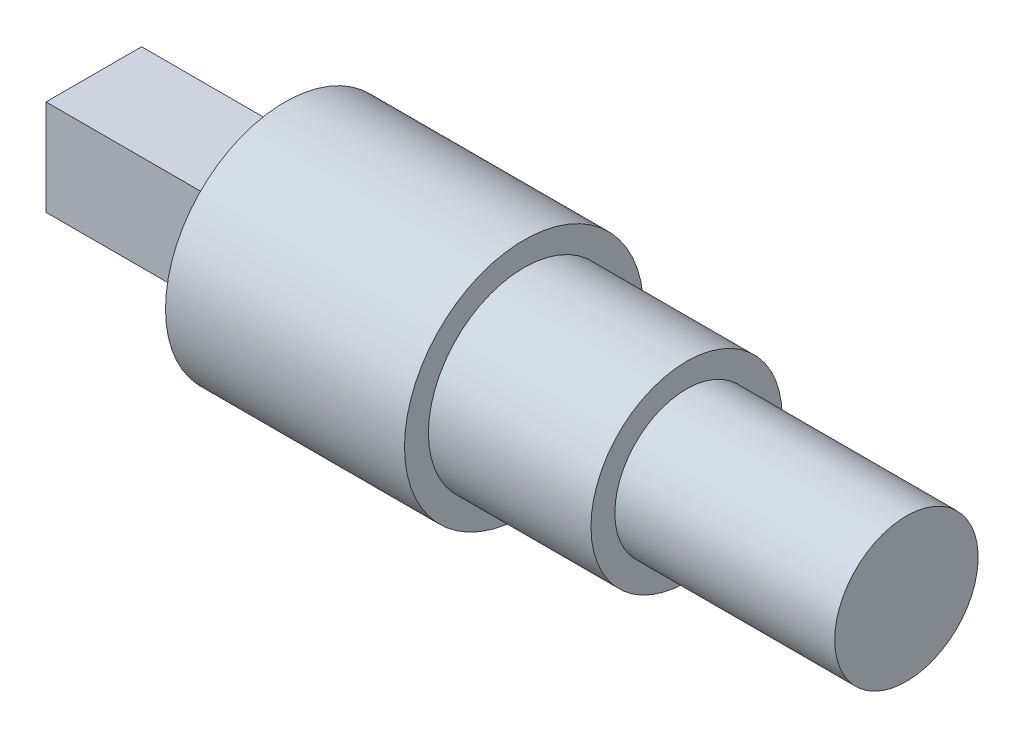
from build123d import *

# Parameters (mm, degrees)
SKETCH_3_W      = 10
SKETCH_3_H      = 10
EXTRUDE_1_DEPTH = 20


with BuildPart() as part:
    # Эскиз2 → Повернуть1 (revolve)
    with BuildSketch(Plane.XY, mode=Mode.PRIVATE) as revolve_1_sk:
        Polygon((0, 0), (0, 5), (20, 5), (20, 12.5), (45, 12.5), (45, 10), (62, 10), (62, 7.5), (85, 7.5), (85, 0), align=None)
    revolve(revolve_1_sk.sketch.rotate(Axis((0, 0, 0), (1, 0, 0)), 90), axis=Axis((0, 0, 0), (1, 0, 0)))

    # Эскиз3 → Бобышка-Вытянуть1 (add)
    with BuildSketch(Plane.ZY):
        Rectangle(SKETCH_3_W, SKETCH_3_H)
    extrude(amount=-EXTRUDE_1_DEPTH)


solid = part.part
